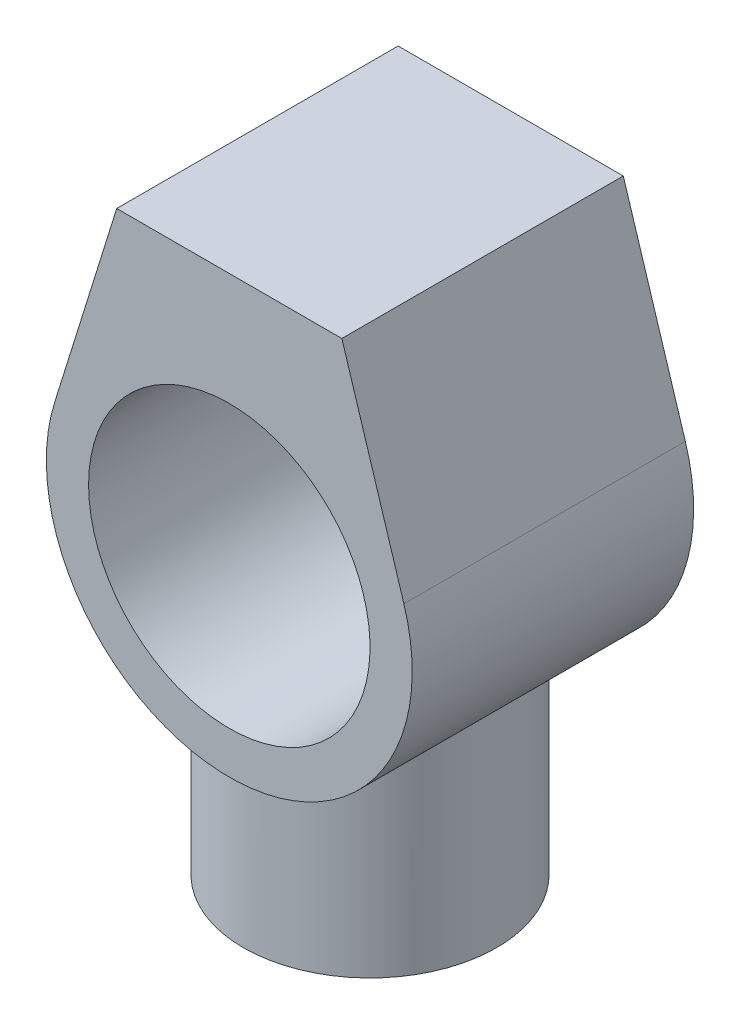
from build123d import *

# Parameters (mm, degrees)
SKETCH1_R                = 50
BOSS_EXTRUDE1_DEPTH      = 50
BOSS_EXTRUDE2_REACH      = 227.444
BOSS_EXTRUDE2_END_RADIUS = 65
SKETCH2_R                = 45
SKETCH2_R_2              = 5
SCALE_1_SCALE            = 0.135064935


with BuildPart() as part:
    # Sketch1 → Boss-Extrude1 (new, symmetric)
    with BuildSketch(Plane.XY):
        with BuildLine():
            Line((-40, 90), (40, 90))
            Line((40, 90), (62.047471254, 19.367790554))
            ThreePointArc((62.047471254, 19.367790554), (0, -65), (-62.047471254, 19.367790554))
            Line((-62.047471254, 19.367790554), (-40, 90))
        make_face()
        with Locations(Location((0, 0, 0), (0, 0, 180))):
            Circle(SKETCH1_R, mode=Mode.SUBTRACT)
    extrude(amount=BOSS_EXTRUDE1_DEPTH, both=True)

    # Boss-Extrude2: up to this cylinder (the profile starts outside it)
    boss_extrude2_end = Plane(origin=(0, 0, 0), z_dir=(0, 0, -1)) * Cylinder(BOSS_EXTRUDE2_END_RADIUS, 585.888, mode=Mode.PRIVATE)
    # Sketch2 → Boss-Extrude2 (add, up to the surface)
    with BuildSketch(Plane(origin=(0, -120, 0), x_dir=(1, 0, 0), z_dir=(0, 1, 0)), mode=Mode.PRIVATE) as boss_extrude2_sk1:
        with Locations(Location((0, 0, 0), (0, 0, 90))):
            Circle(SKETCH2_R)
        with Locations(Location((0, 37, 0), (0, 0, 90))):
            Circle(SKETCH2_R_2, mode=Mode.SUBTRACT)
        with Locations(Location((32.04293994, 18.5, 0), (0, 0, 90))):
            Circle(SKETCH2_R_2, mode=Mode.SUBTRACT)
        with Locations(Location((32.04293994, -18.5, 0), (0, 0, 90))):
            Circle(SKETCH2_R_2, mode=Mode.SUBTRACT)
        with Locations(Location((0, -37, 0), (0, 0, 90))):
            Circle(SKETCH2_R_2, mode=Mode.SUBTRACT)
        with Locations(Location((-32.04293994, -18.5, 0), (0, 0, 90))):
            Circle(SKETCH2_R_2, mode=Mode.SUBTRACT)
        with Locations(Location((-32.04293994, 18.5, 0), (0, 0, 90))):
            Circle(SKETCH2_R_2, mode=Mode.SUBTRACT)
    boss_extrude2_tool1 = extrude(boss_extrude2_sk1.sketch, amount=BOSS_EXTRUDE2_REACH, mode=Mode.PRIVATE) - boss_extrude2_end
    add(boss_extrude2_tool1.solids().sort_by_distance((0, -120, 0))[0])


with BuildPart() as part_1:
    # 缩放比例1: scaled about (6.7865e-05, -8.166687409, 3.34e-07)
    add(part.part.scale(SCALE_1_SCALE).moved(Location((5.8699e-05, -7.063654304, 2.89e-07))))


solid = part_1.part
